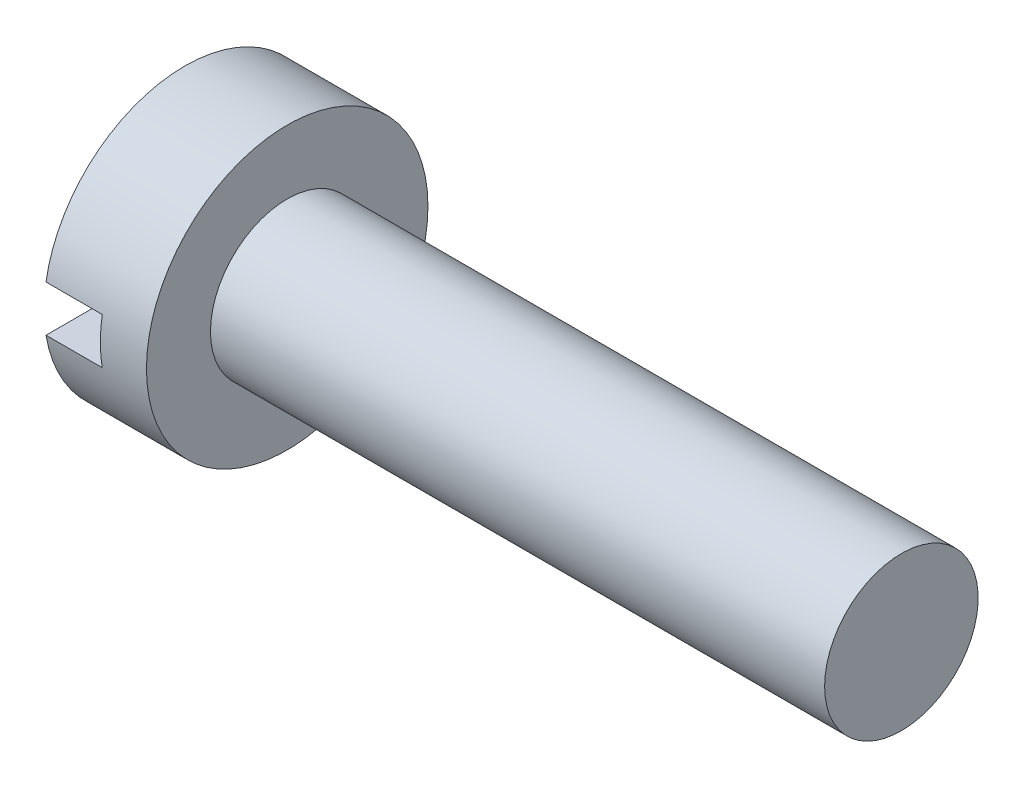
from build123d import *

# Parameters (mm, degrees)
SKETCH2_W  = 5.5
SKETCH2_H  = 0.9
SLOT_DEPTH = 1.1


with BuildPart() as part:
    # BodySke → Base-Revolve (revolve)
    with BuildSketch(Plane.XY, mode=Mode.PRIVATE) as base_revolve_sk:
        Polygon((2, 1.5), (2, 2.75), (0, 2.75), (0, 0), (14, 0), (14, 1.5), align=None)
    revolve(base_revolve_sk.sketch.rotate(Axis((-25.4, 0, 0), (1, 0, 0)), 90), axis=Axis((-25.4, 0, 0), (1, 0, 0)))

    # Sketch2 → Slot (cut)
    with BuildSketch(Plane(origin=(0, 0, 0), x_dir=(0, 0, -1), z_dir=(1, 0, 0))):
        Rectangle(SKETCH2_W, SKETCH2_H)
    extrude(amount=SLOT_DEPTH, mode=Mode.SUBTRACT)


solid = part.part
